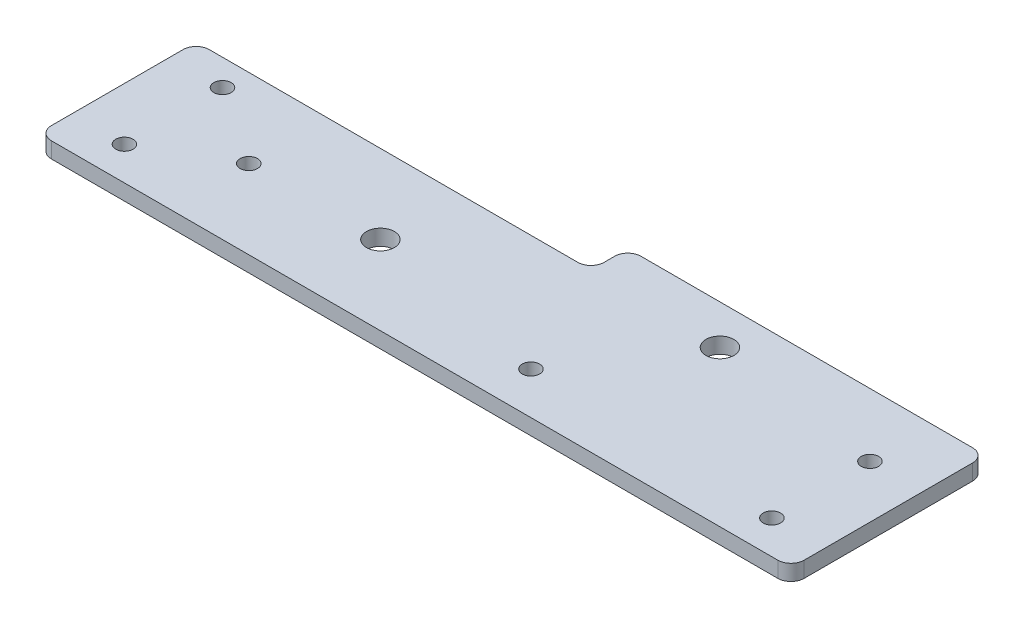
from build123d import *

# Parameters (mm, degrees)
SKETCH_1_R      = 1.65
SKETCH_1_R_2    = 2.65
EXTRUDE_1_DEPTH = 3
FILLET_1_R      = 2.5


with BuildPart() as part:
    # 草图1 → 凸台-拉伸1 (new body)
    with BuildSketch(Plane(origin=(0, 0, 0), x_dir=(1, 0, 0), z_dir=(0, 1, 0))):
        Polygon((0, 0), (143, 0), (143, 37), (75, 37), (75, 30), (0, 30), align=None)
        with Locations(Location((10, 25, 0), (0, 0, 270))):
            Circle(SKETCH_1_R, mode=Mode.SUBTRACT)
        with Locations(Location((10, 6.37, 0), (0, 0, 270))):
            Circle(SKETCH_1_R, mode=Mode.SUBTRACT)
        with Locations(Location((50, 15, 0), (0, 0, 270))):
            Circle(SKETCH_1_R_2, mode=Mode.SUBTRACT)
        with Locations(Location((25, 15, 0), (0, 0, 270))):
            Circle(SKETCH_1_R, mode=Mode.SUBTRACT)
        with Locations(Location((100, 29.5, 0), (0, 0, 270))):
            Circle(SKETCH_1_R_2, mode=Mode.SUBTRACT)
        with Locations(Location((85.6, 8, 0), (0, 0, 270))):
            Circle(SKETCH_1_R, mode=Mode.SUBTRACT)
        with Locations(Location((133, 25, 0), (0, 0, 270))):
            Circle(SKETCH_1_R, mode=Mode.SUBTRACT)
        with Locations(Location((133, 6.37, 0), (0, 0, 270))):
            Circle(SKETCH_1_R, mode=Mode.SUBTRACT)
    extrude(amount=EXTRUDE_1_DEPTH)

    # 圆角1
    fillet_1_edges = [part.edges().sort_by_distance(p)[0] for p in [
        (0, 1.5, -30),
        (75, 1.5, -30),
        (75, 1.5, -37),
        (143, 1.5, -37),
        (143, 1.5, 0),
        (0, 1.5, 0),
    ]]
    fillet(fillet_1_edges, radius=FILLET_1_R)


solid = part.part
